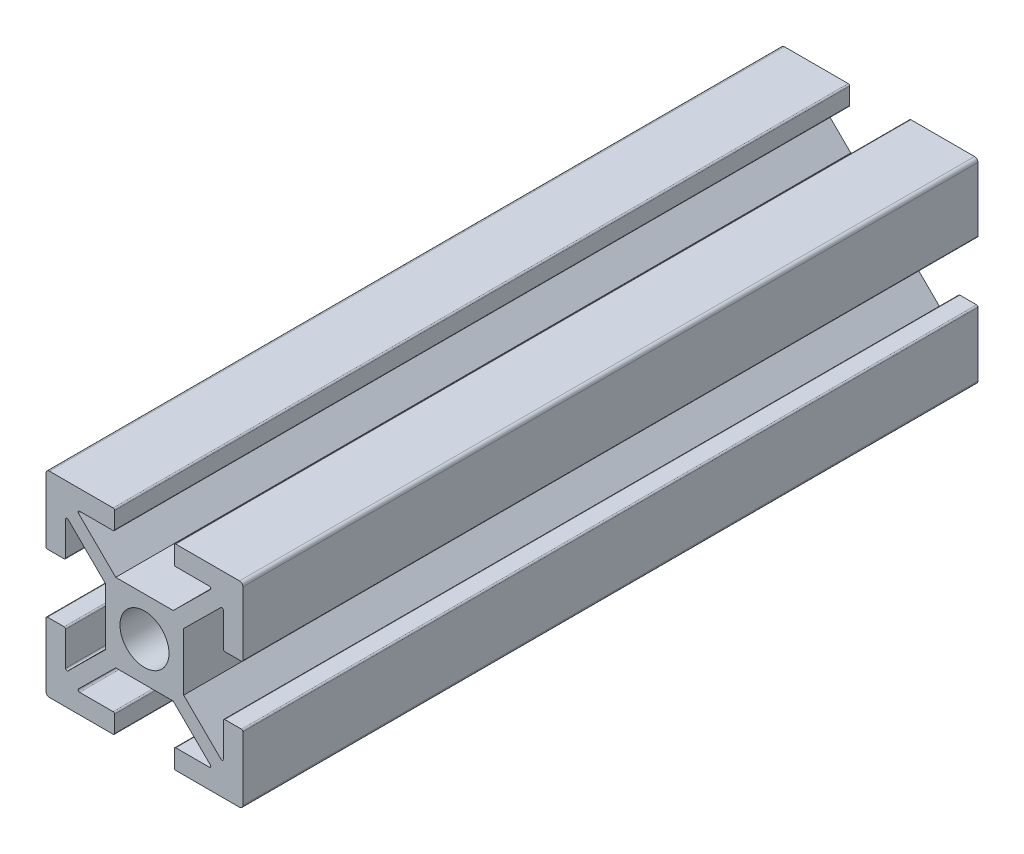
from build123d import *

# Parameters (mm, degrees)
SKETCH1_R           = 2.5
BOSS_EXTRUDE1_DEPTH = 75


with BuildPart() as part:
    # Sketch1 → Boss-Extrude1 (new body)
    with BuildSketch(Plane.XY):
        with BuildLine():
            Line((-7.427382464, 2.155691805), (-5.727382464, 2.155691805))
            ThreePointArc((-5.727382464, 2.155691805), (-5.621316447, 2.199625788), (-5.577382464, 2.305691805))
            Line((-5.577382464, 2.305691805), (-5.577382464, 5.741876319))
            ThreePointArc((-5.577382464, 5.741876319), (-5.485183419, 5.880292537), (-5.321928469, 5.848550846))
            Line((-5.321928469, 5.848550846), (-1.531086168, 2.101082027))
            Line((-1.531086168, 2.101082027), (-1.531086168, -3.789698417))
            Line((-1.531086168, -3.789698417), (-5.321928469, -7.537167236))
            ThreePointArc((-5.321928469, -7.537167236), (-5.485183419, -7.568908927), (-5.577382464, -7.430492708))
            Line((-5.577382464, -7.430492708), (-5.577382464, -3.994308195))
            ThreePointArc((-5.577382464, -3.994308195), (-5.621316447, -3.888242178), (-5.727382464, -3.844308195))
            Line((-5.727382464, -3.844308195), (-7.427382464, -3.844308195))
            ThreePointArc((-7.427382464, -3.844308195), (-7.533448481, -3.888242178), (-7.577382464, -3.994308195))
            Line((-7.577382464, -3.994308195), (-7.577382464, -10.494308195))
            ThreePointArc((-7.577382464, -10.494308195), (-7.474869837, -10.741795568), (-7.227382464, -10.844308195))
            Line((-7.227382464, -10.844308195), (-0.727382464, -10.844308195))
            ThreePointArc((-0.727382464, -10.844308195), (-0.621316447, -10.800374212), (-0.577382464, -10.694308195))
            Line((-0.577382464, -10.694308195), (-0.577382464, -8.994308195))
            ThreePointArc((-0.577382464, -8.994308195), (-0.621316447, -8.888242178), (-0.727382464, -8.844308195))
            Line((-0.727382464, -8.844308195), (-4.145467261, -8.844308195))
            ThreePointArc((-4.145467261, -8.844308195), (-4.284213755, -8.751311795), (-4.250921257, -8.587633667))
            Line((-4.250921257, -8.587633667), (-0.464270258, -4.844308195))
            Line((-0.464270258, -4.844308195), (5.402097922, -4.844308195))
            Line((5.402097922, -4.844308195), (9.188748921, -8.587633667))
            ThreePointArc((9.188748921, -8.587633667), (9.22204142, -8.751311795), (9.083294926, -8.844308195))
            Line((9.083294926, -8.844308195), (5.665210129, -8.844308195))
            ThreePointArc((5.665210129, -8.844308195), (5.559144111, -8.888242178), (5.515210129, -8.994308195))
            Line((5.515210129, -8.994308195), (5.515210129, -10.694308195))
            ThreePointArc((5.515210129, -10.694308195), (5.559144111, -10.800374212), (5.665210129, -10.844308195))
            Line((5.665210129, -10.844308195), (12.165210129, -10.844308195))
            ThreePointArc((12.165210129, -10.844308195), (12.412697502, -10.741795568), (12.515210129, -10.494308195))
            Line((12.515210129, -10.494308195), (12.515210129, -3.994308195))
            ThreePointArc((12.515210129, -3.994308195), (12.471276146, -3.888242178), (12.365210129, -3.844308195))
            Line((12.365210129, -3.844308195), (10.665210129, -3.844308195))
            ThreePointArc((10.665210129, -3.844308195), (10.559144111, -3.888242178), (10.515210129, -3.994308195))
            Line((10.515210129, -3.994308195), (10.515210129, -7.430492708))
            ThreePointArc((10.515210129, -7.430492708), (10.423011083, -7.568908927), (10.259756133, -7.537167236))
            Line((10.259756133, -7.537167236), (6.468913832, -3.789698417))
            Line((6.468913832, -3.789698417), (6.468913832, 2.101082027))
            Line((6.468913832, 2.101082027), (10.259756133, 5.848550846))
            ThreePointArc((10.259756133, 5.848550846), (10.423011083, 5.880292537), (10.515210129, 5.741876319))
            Line((10.515210129, 5.741876319), (10.515210129, 2.305691805))
            ThreePointArc((10.515210129, 2.305691805), (10.559144111, 2.199625788), (10.665210129, 2.155691805))
            Line((10.665210129, 2.155691805), (12.365210129, 2.155691805))
            ThreePointArc((12.365210129, 2.155691805), (12.471276146, 2.199625788), (12.515210129, 2.305691805))
            Line((12.515210129, 2.305691805), (12.515210129, 8.805691805))
            ThreePointArc((12.515210129, 8.805691805), (12.412697502, 9.053179179), (12.165210129, 9.155691805))
            Line((12.165210129, 9.155691805), (5.665210129, 9.155691805))
            ThreePointArc((5.665210129, 9.155691805), (5.559144111, 9.111757822), (5.515210129, 9.005691805))
            Line((5.515210129, 9.005691805), (5.515210129, 7.305691805))
            ThreePointArc((5.515210129, 7.305691805), (5.559144111, 7.199625788), (5.665210129, 7.155691805))
            Line((5.665210129, 7.155691805), (9.083294926, 7.155691805))
            ThreePointArc((9.083294926, 7.155691805), (9.22204142, 7.062695405), (9.188748921, 6.899017277))
            Line((9.188748921, 6.899017277), (5.402097922, 3.155691805))
            Line((5.402097922, 3.155691805), (-0.464270258, 3.155691805))
            Line((-0.464270258, 3.155691805), (-4.250921257, 6.899017277))
            ThreePointArc((-4.250921257, 6.899017277), (-4.284213755, 7.062695405), (-4.145467261, 7.155691805))
            Line((-4.145467261, 7.155691805), (-0.727382464, 7.155691805))
            ThreePointArc((-0.727382464, 7.155691805), (-0.621316447, 7.199625788), (-0.577382464, 7.305691805))
            Line((-0.577382464, 7.305691805), (-0.577382464, 9.005691805))
            ThreePointArc((-0.577382464, 9.005691805), (-0.621316447, 9.111757822), (-0.727382464, 9.155691805))
            Line((-0.727382464, 9.155691805), (-7.227382464, 9.155691805))
            ThreePointArc((-7.227382464, 9.155691805), (-7.474869837, 9.053179179), (-7.577382464, 8.805691805))
            Line((-7.577382464, 8.805691805), (-7.577382464, 2.305691805))
            ThreePointArc((-7.577382464, 2.305691805), (-7.533448481, 2.199625788), (-7.427382464, 2.155691805))
        make_face()
        with Locations((2.468913832, -0.844308195)):
            Circle(SKETCH1_R, mode=Mode.SUBTRACT)
    extrude(amount=BOSS_EXTRUDE1_DEPTH)


solid = part.part
